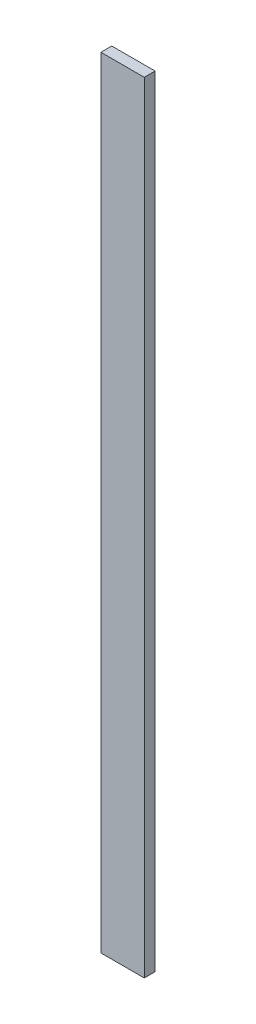
from build123d import *

# Parameters (mm, degrees)
SKETCH1_W           = 25.4
SKETCH1_H           = 457.2
BOSS_EXTRUDE1_DEPTH = 6.35


with BuildPart() as part:
    # Sketch1 → Boss-Extrude1 (new body)
    with BuildSketch(Plane.XY):
        Rectangle(SKETCH1_W, SKETCH1_H)
    extrude(amount=BOSS_EXTRUDE1_DEPTH)


solid = part.part
